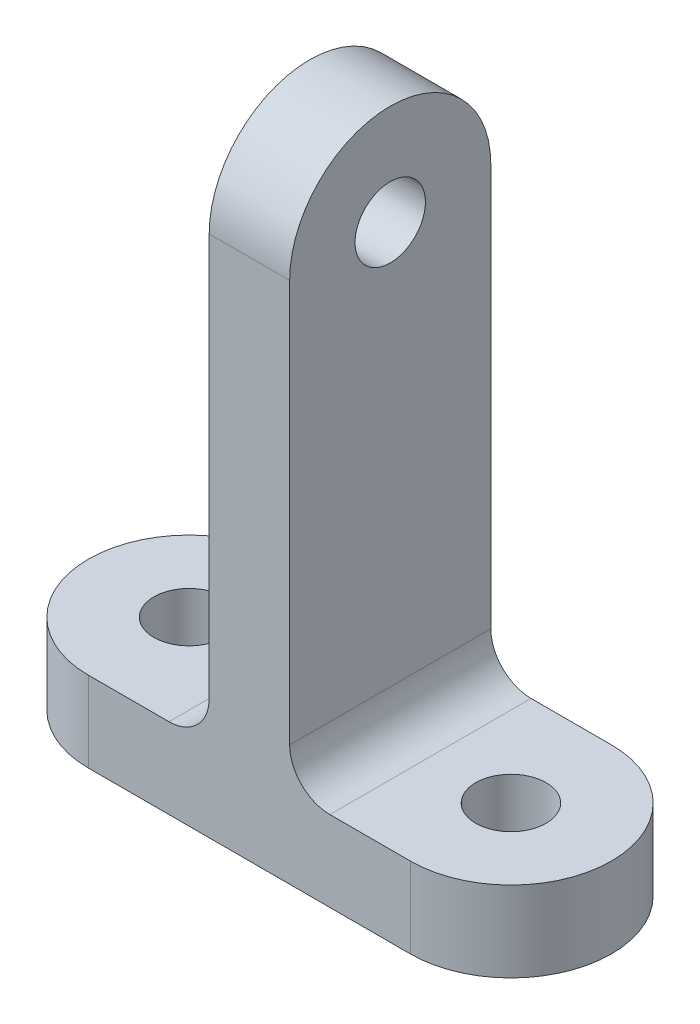
from build123d import *

# Parameters (mm, degrees)
SKETCH1_R           = 5
SKETCH1_R_2         = 1.75
BOSS_EXTRUDE1_DEPTH = 4
SKETCH2_W           = 4
SKETCH2_H           = 10
BOSS_EXTRUDE2_DEPTH = 27
SKETCH3_R           = 1.75
CUT_EXTRUDE1_DEPTH  = 4
FILLET1_R           = 2
FILLET2_R           = 2


with BuildPart() as part:
    # Sketch1 → Boss-Extrude1 (new body)
    # profile 1 of 3: a face of its own
    with BuildSketch(Plane(origin=(0, 0, 0), x_dir=(1, 0, 0), z_dir=(0, 1, 0))):
        with Locations((-8, 0)):
            Circle(SKETCH1_R)
        with Locations(Location((-8, 0, 0), (0, 0, 270))):
            Circle(SKETCH1_R_2, mode=Mode.SUBTRACT)
    # profile 2 of 3: a face of its own
    with BuildSketch(Plane(origin=(0, 0, 0), x_dir=(1, 0, 0), z_dir=(0, 1, 0))):
        with BuildLine():
            Line((8, 5), (-8, 5))
            ThreePointArc((-8, 5), (-4.464466094, 3.535533906), (-3, 0))
            ThreePointArc((-3, 0), (-4.464466094, -3.535533906), (-8, -5))
            Line((-8, -5), (8, -5))
            ThreePointArc((8, -5), (3, 0), (8, 5))
        make_face()
    # profile 3 of 3: a face of its own
    with BuildSketch(Plane(origin=(0, 0, 0), x_dir=(1, 0, 0), z_dir=(0, 1, 0))):
        with Locations((8, 0)):
            Circle(SKETCH1_R)
        with Locations(Location((8, 0, 0), (0, 0, 270))):
            Circle(SKETCH1_R_2, mode=Mode.SUBTRACT)
    extrude(amount=BOSS_EXTRUDE1_DEPTH)

    # Sketch2 → Boss-Extrude2 (add)
    with BuildSketch(Plane(origin=(0, 4, 0), x_dir=(1, 0, 0), z_dir=(0, 1, 0))):
        Rectangle(SKETCH2_W, SKETCH2_H)
    extrude(amount=BOSS_EXTRUDE2_DEPTH)

    # Sketch3 → Cut-Extrude1 (cut)
    with BuildSketch(Plane(origin=(2, 0, 0), x_dir=(0, 0, -1), z_dir=(1, 0, 0))):
        with BuildLine():
            Line((-5, 31), (-5, 26))
            ThreePointArc((-5, 26), (-3.535533906, 29.535533906), (0, 31))
            Line((0, 31), (-5, 31))
        make_face()
        with BuildLine():
            ThreePointArc((0, 31), (3.535533906, 29.535533906), (5, 26))
            Line((5, 26), (5, 31))
            Line((5, 31), (0, 31))
        make_face()
        with Locations((0, 26)):
            Circle(SKETCH3_R)
    extrude(amount=-CUT_EXTRUDE1_DEPTH, mode=Mode.SUBTRACT)

    # Fillet1
    fillet1_edges = [part.edges().sort_by_distance(p)[0] for p in [
        (2, 4, 0),
    ]]
    fillet(fillet1_edges, radius=FILLET1_R)

    # Fillet2
    fillet2_edges = [part.edges().sort_by_distance(p)[0] for p in [
        (-2, 4, 0),
    ]]
    fillet(fillet2_edges, radius=FILLET2_R)


solid = part.part
